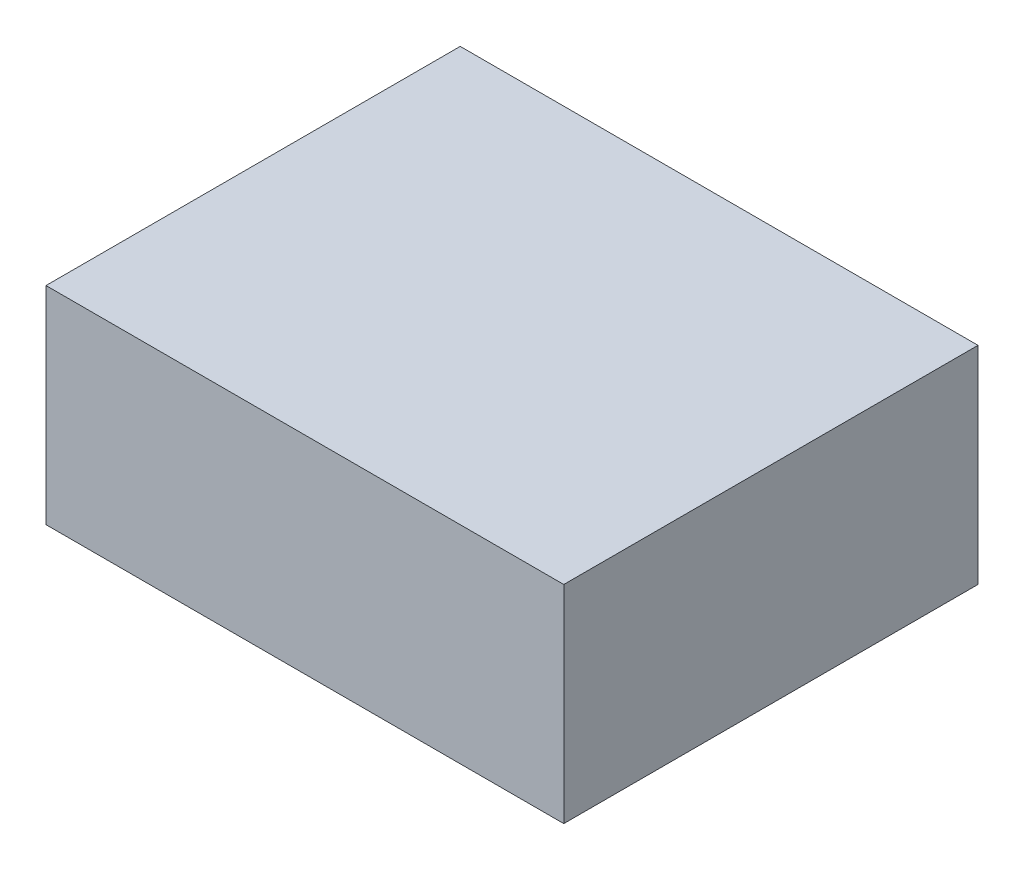
from build123d import *

# Parameters (mm, degrees)
SKETCH1_W           = 95.25
SKETCH1_H           = 38.1
BOSS_EXTRUDE1_DEPTH = 76.2


with BuildPart() as part:
    # Sketch1 → Boss-Extrude1 (new body)
    with BuildSketch(Plane.XY):
        with Locations((47.625, 19.05)):
            Rectangle(SKETCH1_W, SKETCH1_H)
    extrude(amount=BOSS_EXTRUDE1_DEPTH)


solid = part.part
